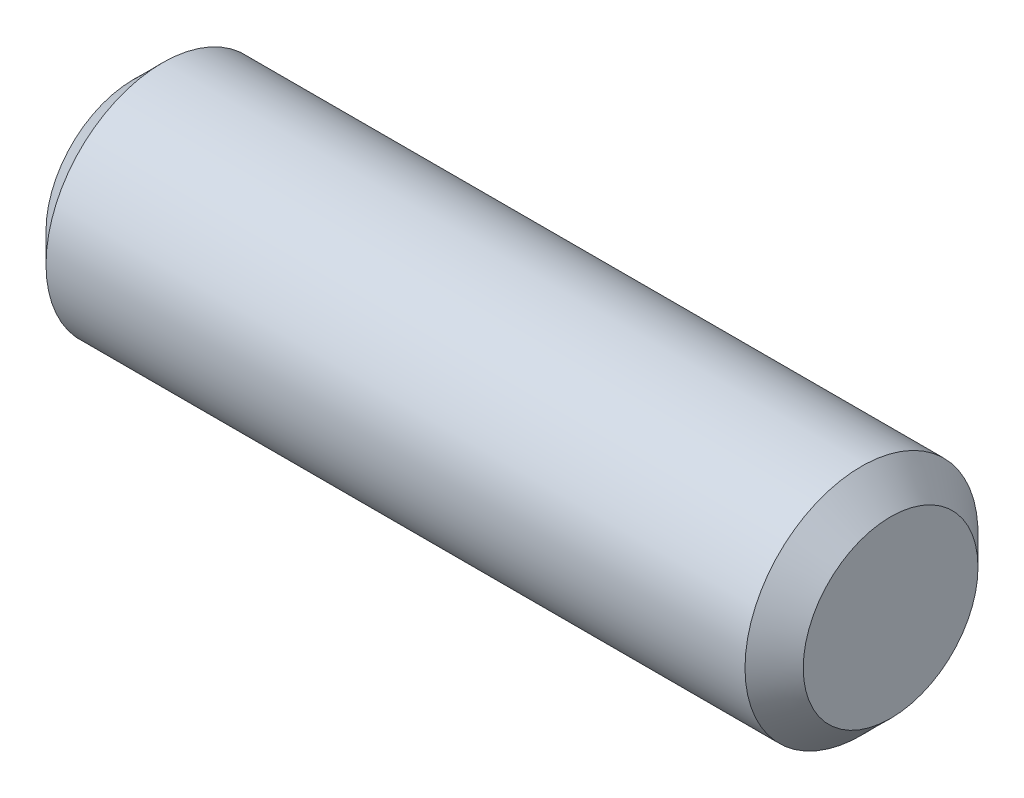
from build123d import *

# Parameters (mm, degrees)
SKETCH2_R           = 2
BOSS_EXTRUDE1_DEPTH = 13
CHAMFER1_SIZE       = 0.5
ECHELLE1_SCALE      = 2
ECHELLE2_SCALE      = 0.25


with BuildPart() as part:
    # Sketch2 → Boss-Extrude1 (new body)
    with BuildSketch(Plane(origin=(0, 0, 0), x_dir=(0, 0, -1), z_dir=(1, 0, 0))):
        with Locations(Location((0, 0, 0), (0, 0, 180))):
            Circle(SKETCH2_R)
    extrude(amount=BOSS_EXTRUDE1_DEPTH)

    # Chamfer1
    chamfer1_edges = [part.edges().sort_by_distance(p)[0] for p in [
        (0, 0, -2),
        (13, 0, -2),
    ]]
    chamfer(chamfer1_edges, length=CHAMFER1_SIZE)


with BuildPart() as part_1:
    # Echelle1: scaled about (6.5, 0, 0)
    add(part.part.scale(ECHELLE1_SCALE).moved(Location((-6.5, 0, 0))))


with BuildPart() as part_2:
    # Echelle2: scaled about (6.5, 0, 0)
    add(part_1.part.scale(ECHELLE2_SCALE).moved(Location((4.875, 0, 0))))


solid = part_2.part
